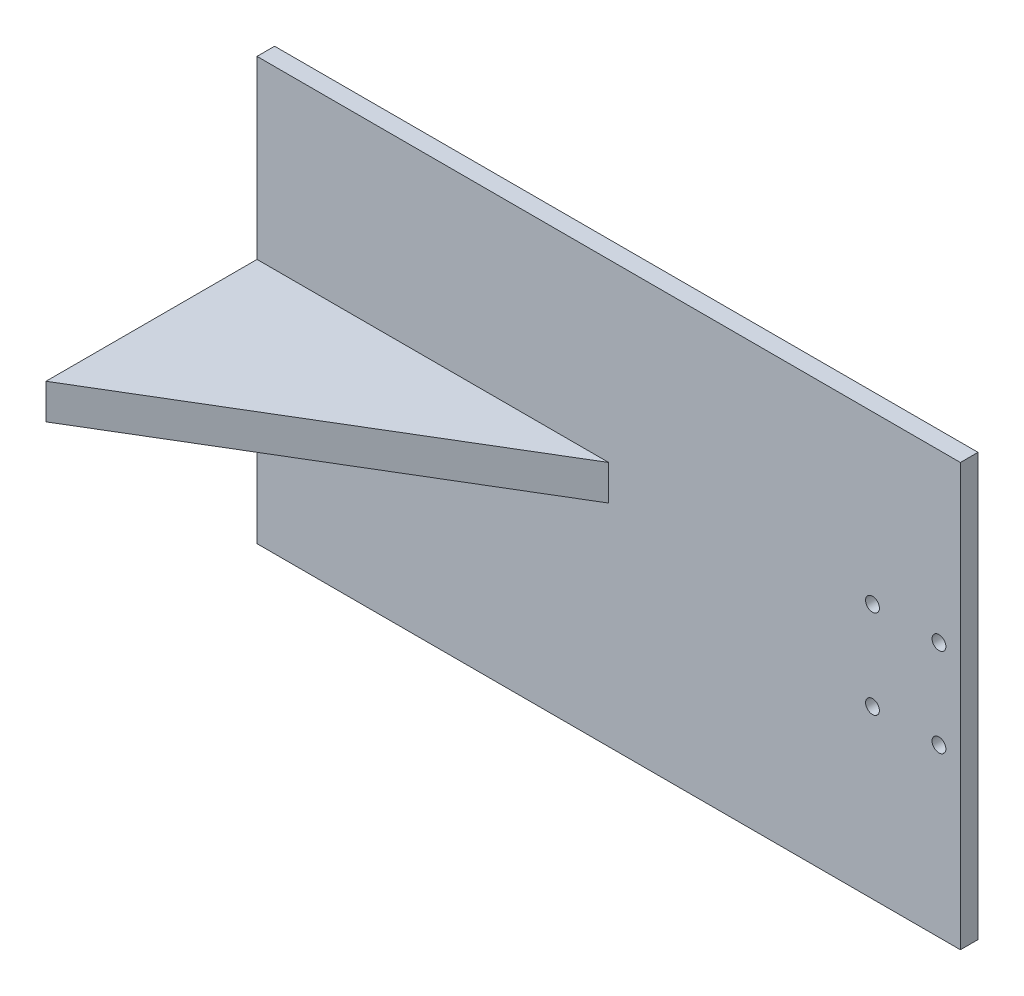
from build123d import *

# Parameters (mm, degrees)
ESQUISSE1_W             = 127
ESQUISSE1_H             = 76.2
BOSS_EXTRU_1_DEPTH      = 1.5875
ESQUISSE2_R             = 1.24968
ENL_V_MAT_EXTRU_1_DEPTH = 75.121121315
BOSS_EXTRUDE1_DEPTH     = 6.35


with BuildPart() as part:
    # Esquisse1 → Boss.-Extru.1 (new, symmetric)
    with BuildSketch(Plane.XY):
        Rectangle(ESQUISSE1_W, ESQUISSE1_H)
    extrude(amount=BOSS_EXTRU_1_DEPTH, both=True)

    # Esquisse2 → Enlèv. mat.-Extru.1 (cut, through all)
    with BuildSketch(Plane.XY.offset(1.5875)):
        with Locations((47.625, 8)):
            Circle(ESQUISSE2_R)
        with Locations((59.625, 8)):
            Circle(ESQUISSE2_R)
    enl_v_mat_extru_1 = extrude(amount=-ENL_V_MAT_EXTRU_1_DEPTH, mode=Mode.SUBTRACT)

    # Symétrie1: Enlèv. mat.-Extru.1 across plane
    add(enl_v_mat_extru_1.mirror(Plane.ZX), mode=Mode.SUBTRACT)

    # Sketch1 → Boss-Extrude1 (add)
    with BuildSketch(Plane(origin=(0, 0, 0), x_dir=(1, 0, 0), z_dir=(0, 1, 0))):
        Polygon((-63.5, -1.5875), (-63.5, -39.6875), (0, -1.5875), align=None)
    extrude(amount=BOSS_EXTRUDE1_DEPTH)


solid = part.part
